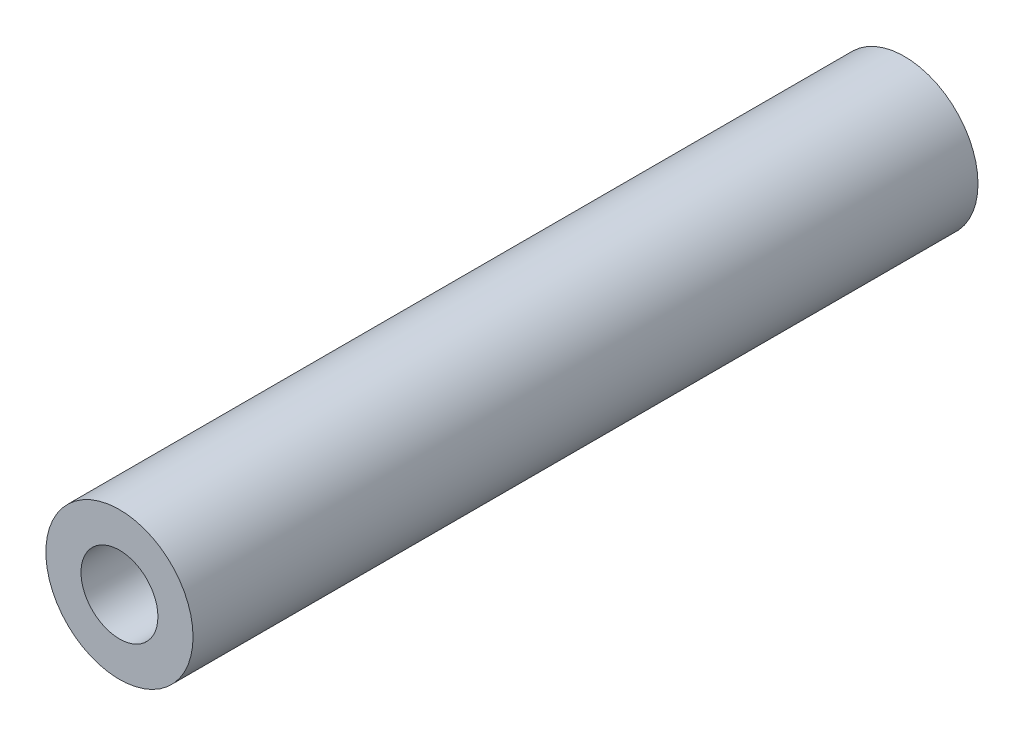
from build123d import *

# Parameters (mm, degrees)
SKETCH1_R           = 4.7625
SKETCH1_R_2         = 2.4892
BOSS_EXTRUDE1_DEPTH = 25.4


with BuildPart() as part:
    # Sketch1 → Boss-Extrude1 (new, symmetric)
    with BuildSketch(Plane.XY):
        Circle(SKETCH1_R)
        Circle(SKETCH1_R_2, mode=Mode.SUBTRACT)
    extrude(amount=BOSS_EXTRUDE1_DEPTH, both=True)


solid = part.part
